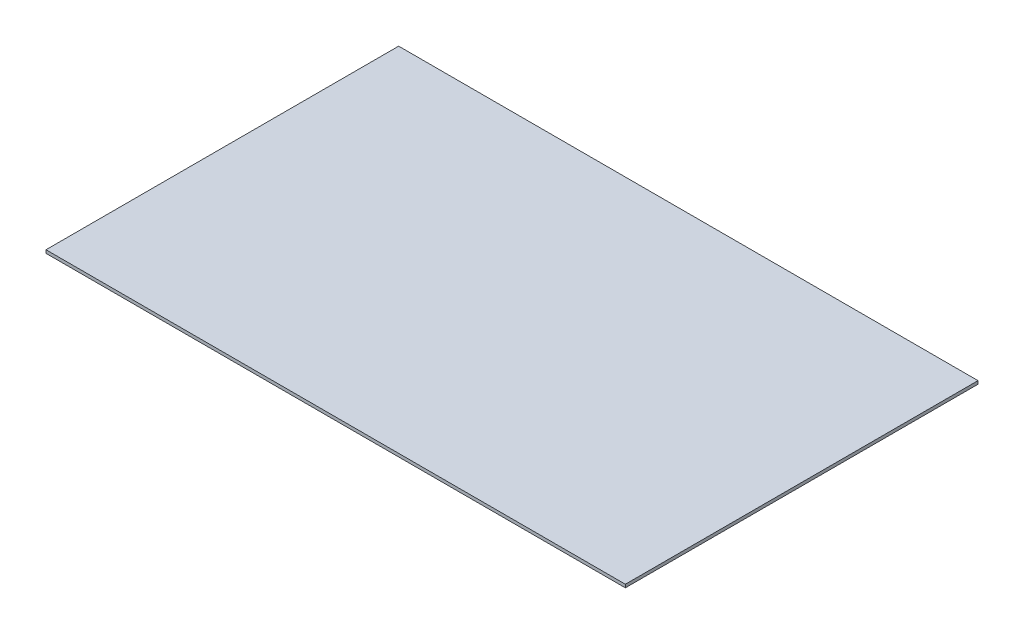
from build123d import *

# Parameters (mm, degrees)
SKETCH1_W           = 584.2
SKETCH1_H           = 355.6
BOSS_EXTRUDE1_DEPTH = 3.175


with BuildPart() as part:
    # Sketch1 → Boss-Extrude1 (new body)
    with BuildSketch(Plane(origin=(0, 0, 0), x_dir=(1, 0, 0), z_dir=(0, 1, 0))):
        with Locations((292.1, 177.8)):
            Rectangle(SKETCH1_W, SKETCH1_H)
    extrude(amount=BOSS_EXTRUDE1_DEPTH)


solid = part.part
